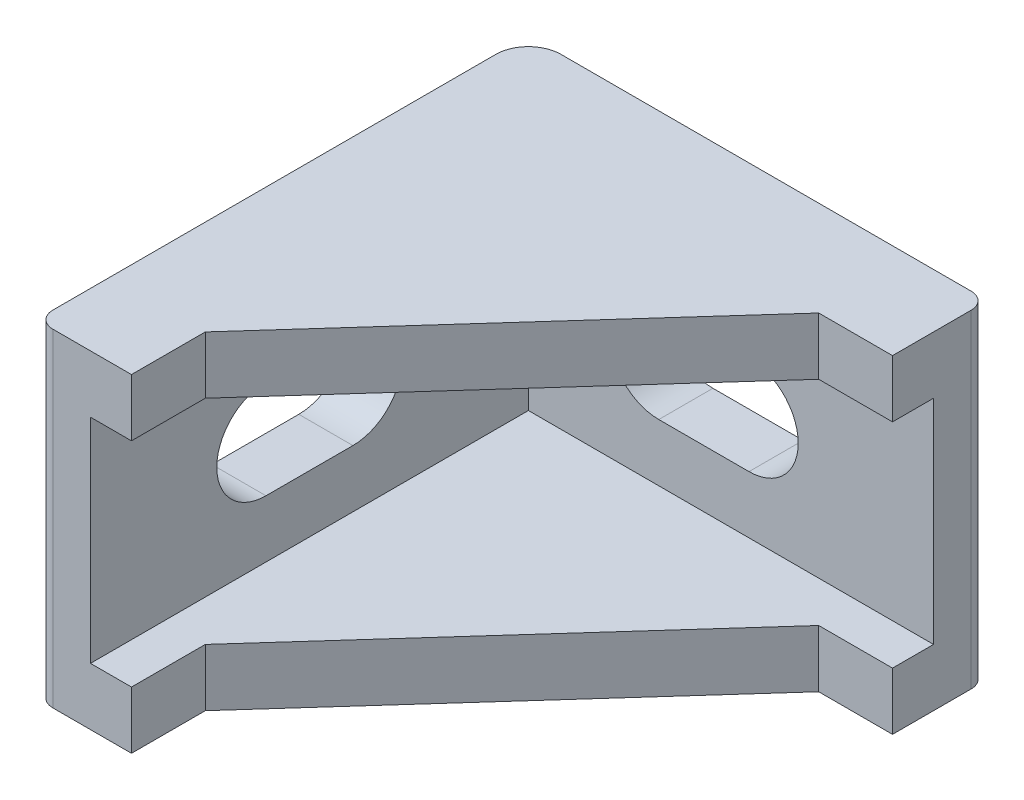
from build123d import *

# Parameters (mm, degrees)
SKETCH1_W           = 28
SKETCH1_H           = 20
BOSS_EXTRUDE1_DEPTH = 3.3
SKETCH2_W           = 3.3
SKETCH2_H           = 20
BOSS_EXTRUDE2_DEPTH = 26.7
CUT_EXTRUDE1_DEPTH  = 44.704576419
BOSS_EXTRUDE3_DEPTH = 3.5
BOSS_EXTRUDE4_DEPTH = 3.5
FILLET1_R           = 2
FILLET2_R           = 1
FILLET3_R           = 1


with BuildPart() as part:
    # Sketch1 → Boss-Extrude1 (new body)
    with BuildSketch(Plane.XY):
        with Locations((14, 10)):
            Rectangle(SKETCH1_W, SKETCH1_H)
        with BuildLine():
            Line((11.25, 13), (16.75, 13))
            ThreePointArc((16.75, 13), (19.75, 10), (16.75, 7))
            Line((16.75, 7), (11.25, 7))
            ThreePointArc((11.25, 7), (8.25, 10), (11.25, 13))
        make_face(mode=Mode.SUBTRACT)
    extrude(amount=BOSS_EXTRUDE1_DEPTH)

    # Sketch2 → Boss-Extrude2 (add)
    with BuildSketch(Plane.XY.offset(3.3)):
        with Locations((1.65, 10)):
            Rectangle(SKETCH2_W, SKETCH2_H)
    extrude(amount=BOSS_EXTRUDE2_DEPTH)

    # Sketch3 → Cut-Extrude1 (cut, through all)
    with BuildSketch(Plane(origin=(3.3, 0, 0), x_dir=(0, 0, -1), z_dir=(1, 0, 0))):
        with BuildLine():
            Line((-19.3, 13), (-14, 13))
            ThreePointArc((-14, 13), (-11, 10), (-14, 7))
            Line((-14, 7), (-19.3, 7))
            ThreePointArc((-19.3, 7), (-22.3, 10), (-19.3, 13))
        make_face()
    extrude(amount=-CUT_EXTRUDE1_DEPTH, mode=Mode.SUBTRACT)

    # Sketch4 → Boss-Extrude3 (add)
    with BuildSketch(Plane.XZ):
        Polygon((3.3, 30), (5.8, 30), (5.8, 25.5), (23.5, 5.8), (28, 5.8), (28, 3.3), (3.3, 3.3), align=None)
    extrude(amount=-BOSS_EXTRUDE3_DEPTH)

    # Sketch5 → Boss-Extrude4 (add)
    with BuildSketch(Plane(origin=(0, 20, 0), x_dir=(1, 0, 0), z_dir=(0, 1, 0))):
        Polygon((28, -3.3), (28, -5.8), (23.5, -5.8), (5.8, -25.5), (5.8, -30), (3.3, -30), (3.3, -3.3), align=None)
    extrude(amount=-BOSS_EXTRUDE4_DEPTH)

    # Fillet1
    fillet1_edges = [part.edges().sort_by_distance(p)[0] for p in [
        (0, 10, 0),
    ]]
    fillet(fillet1_edges, radius=FILLET1_R)

    # Fillet2
    fillet2_edges = [part.edges().sort_by_distance(p)[0] for p in [
        (0, 10, 30),
    ]]
    fillet(fillet2_edges, radius=FILLET2_R)

    # Fillet3
    fillet3_edges = [part.edges().sort_by_distance(p)[0] for p in [
        (28, 10, 0),
    ]]
    fillet(fillet3_edges, radius=FILLET3_R)


solid = part.part
